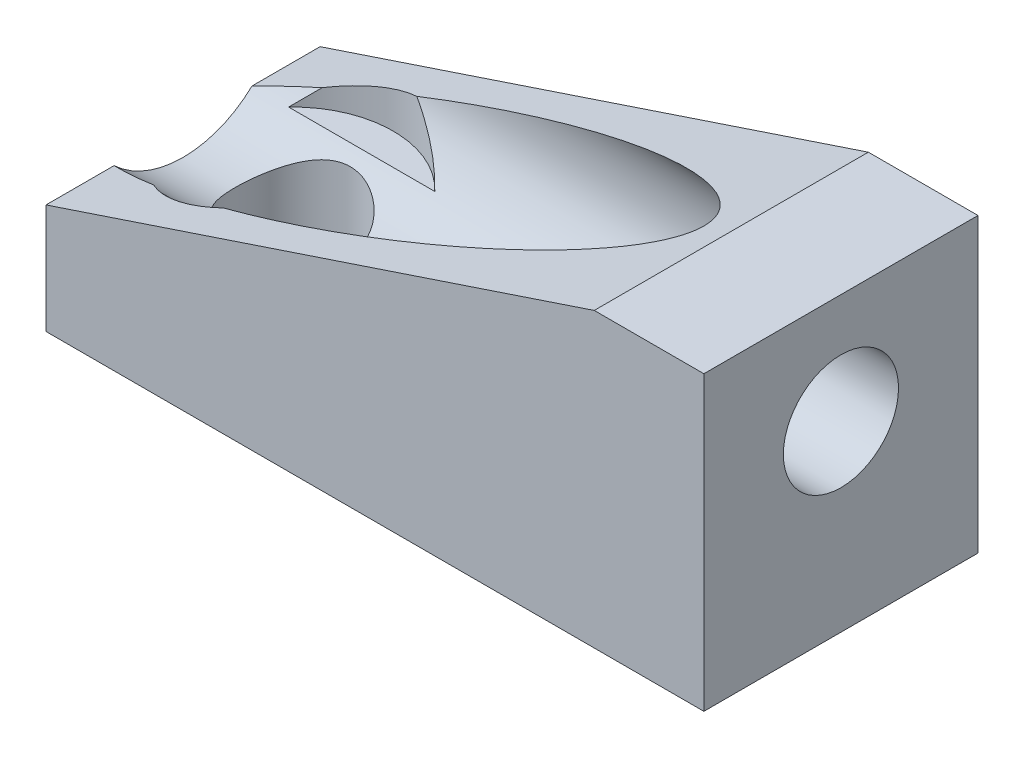
from build123d import *

# Parameters (mm, degrees)
BOSS_EXTRUDE2_DEPTH = 15
SKETCH4_R           = 3.15
CUT_EXTRUDE1_DEPTH  = 46.776415929
SKETCH4_3_R         = 5.5
SKETCH4_3_R_2       = 3.15
CUT_EXTRUDE2_DEPTH  = 14
SKETCH6_R           = 3.15
CUT_EXTRUDE3_DEPTH  = 45.175561743
SKETCH6_3_R         = 5.5
SKETCH6_3_R_2       = 3.15
CUT_EXTRUDE4_DEPTH  = 32.34684153


with BuildPart() as part:
    # Sketch3 → Boss-Extrude2 (new body)
    with BuildSketch(Plane.XY):
        Polygon((2.34684153, 0), (38.34684153, 0), (38.34684153, 16), (32.34684153, 16), (2.34684153, 6), align=None)
    extrude(amount=BOSS_EXTRUDE2_DEPTH)

    # Sketch4 → Cut-Extrude1 (cut, through all)
    with BuildSketch(Plane(origin=(0, 20, 0), x_dir=(1, 0, 0), z_dir=(0, 1, 0))):
        with Locations(Location((8.34684153, -7.5, 0), (0, 0, 270))):
            Circle(SKETCH4_R)
    extrude(amount=-CUT_EXTRUDE1_DEPTH, mode=Mode.SUBTRACT)

    # Sketch4<3> → Cut-Extrude2 (cut)
    with BuildSketch(Plane(origin=(0, 20, 0), x_dir=(1, 0, 0), z_dir=(0, 1, 0))):
        with Locations(Location((8.34684153, -7.5, 0), (0, 0, 270))):
            Circle(SKETCH4_3_R)
        with Locations(Location((8.34684153, -7.5, 0), (0, 0, 270))):
            Circle(SKETCH4_3_R_2, mode=Mode.SUBTRACT)
    extrude(amount=-CUT_EXTRUDE2_DEPTH, mode=Mode.SUBTRACT)

    # Sketch6 → Cut-Extrude3 (cut, through all)
    with BuildSketch(Plane(origin=(0, 0, 0), x_dir=(0, 0, -1), z_dir=(1, 0, 0))):
        with Locations(Location((-7.5, 10, 0), (0, 0, 188.918497492))):
            Circle(SKETCH6_R)
    extrude(amount=CUT_EXTRUDE3_DEPTH, mode=Mode.SUBTRACT)

    # Sketch6<3> → Cut-Extrude4 (cut)
    with BuildSketch(Plane(origin=(0, 0, 0), x_dir=(0, 0, -1), z_dir=(1, 0, 0))):
        with Locations(Location((-7.5, 10, 0), (0, 0, 180))):
            Circle(SKETCH6_3_R)
        with Locations(Location((-7.5, 10, 0), (0, 0, 180))):
            Circle(SKETCH6_3_R_2, mode=Mode.SUBTRACT)
    extrude(amount=CUT_EXTRUDE4_DEPTH, mode=Mode.SUBTRACT)


solid = part.part
